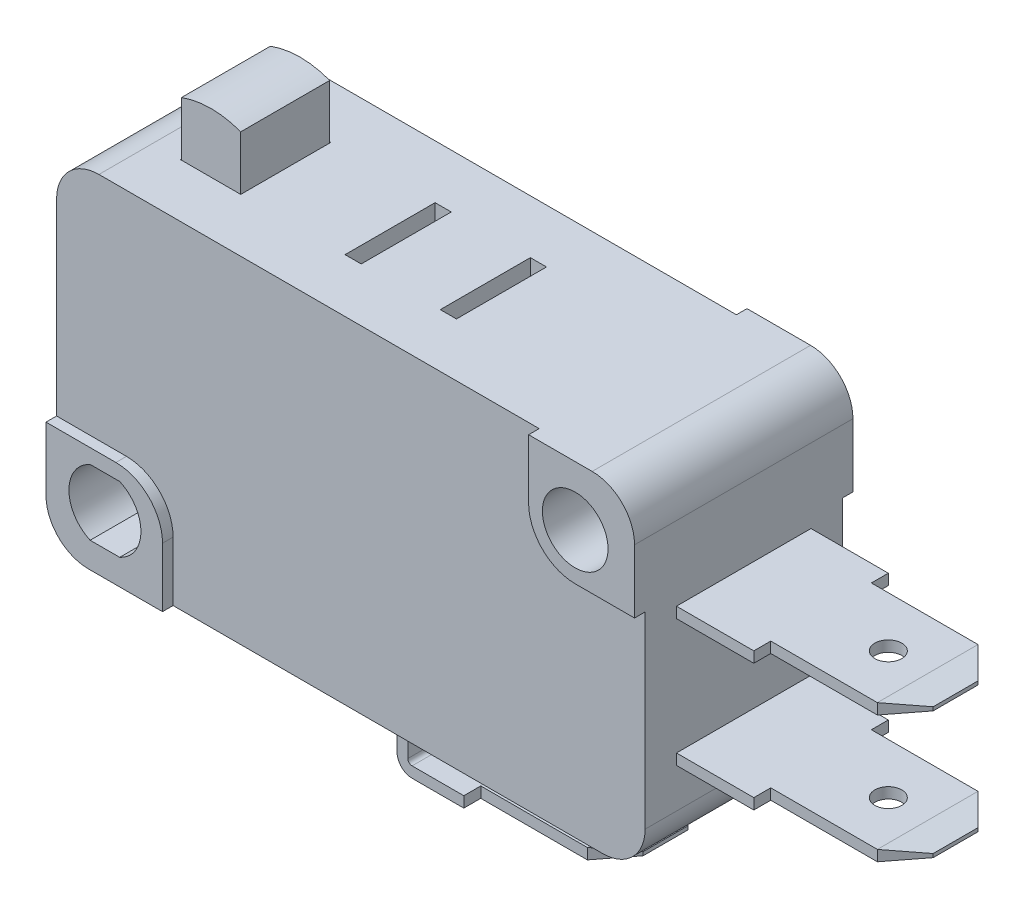
from build123d import *

# Parameters (mm, degrees)
SKETCH1_W               = 27.78125
SKETCH1_H               = 15.875
SKETCH1_R               = 1.55
EXTRUDE1_DEPTH          = 5.155
FILLET1_R               = 2
EXTRUDE2_DEPTH          = 2.1
SKETCH3_W               = 2.8508
SKETCH3_H               = 4.2508
SKETCH3_W_2             = 0.762
CUT_EXTRUDE1_DEPTH      = 2
CUT_EXTRUDE2_DEPTH      = 0.5
EXTRUDE3_DEPTH          = 3.175
SKETCH6_R               = 0.635
CUT_EXTRUDE3_DEPTH      = 26.744998173
EXTRUDE4_START          = -5.5
SKETCH8_R               = 0.635
EXTRUDE4_DEPTH          = 0.508
LPATTERN1_COUNT         = 2
LPATTERN1_PITCH         = 6
CUT_EXTRUDE4_DEPTH      = 27.735508115
CUT_EXTRUDE4_DEPTH_BACK = 27.735508115


with BuildPart() as part:
    # Sketch1 → Extrude1 (new, symmetric)
    with BuildSketch(Plane.XY):
        Rectangle(SKETCH1_W, SKETCH1_H)
        with Locations((11.090625, 5.1435)):
            Circle(SKETCH1_R, mode=Mode.SUBTRACT)
        with BuildLine():
            Line((-11.807587002, -3.62525), (-10.411162998, -3.62525))
            ThreePointArc((-10.411162998, -3.62525), (-9.409375, -5.17525), (-10.411162998, -6.72525))
            Line((-10.411162998, -6.72525), (-11.807587002, -6.72525))
            ThreePointArc((-11.807587002, -6.72525), (-12.809375, -5.17525), (-11.807587002, -3.62525))
        make_face(mode=Mode.SUBTRACT)
    extrude(amount=EXTRUDE1_DEPTH, both=True)

    # Fillet1
    fillet1_edges = [part.edges().sort_by_distance(p)[0] for p in [
        (-13.890625, 7.9375, 0),
        (13.890625, 7.9375, 0),
        (13.890625, -7.9375, 0),
        (-13.890625, -7.9375, 0),
    ]]
    fillet(fillet1_edges, radius=FILLET1_R)

    # Sketch3 → Cut-Extrude1 (cut)
    with BuildSketch(Plane(origin=(0, 7.9375, 0), x_dir=(-1, 0, 0), z_dir=(0, 1, 0))):
        with Locations((9.153175, 0)):
            Rectangle(SKETCH3_W, SKETCH3_H)
        with Locations((2.422175, 0)):
            Rectangle(SKETCH3_W_2, SKETCH3_H)
        with Locations((-2.073625, 0)):
            Rectangle(SKETCH3_W_2, SKETCH3_H)
    extrude(amount=-CUT_EXTRUDE1_DEPTH, mode=Mode.SUBTRACT)

    # Sketch4 → Cut-Extrude2 (cut)
    with BuildSketch(Plane.XY.offset(5.155)):
        with BuildLine():
            Line((-8.390625, -7.9375), (13.890625, -7.9375))
            Line((13.890625, -7.9375), (13.890625, 2.9435))
            Line((13.890625, 2.9435), (11.090625, 2.9435))
            ThreePointArc((11.090625, 2.9435), (9.534990081, 3.587865081), (8.890625, 5.1435))
            Line((8.890625, 5.1435), (8.890625, 7.9375))
            Line((8.890625, 7.9375), (-13.890625, 7.9375))
            Line((-13.890625, 7.9375), (-13.890625, -2.9375))
            Line((-13.890625, -2.9375), (-10.590625, -2.9375))
            ThreePointArc((-10.590625, -2.9375), (-9.034990081, -3.581865081), (-8.390625, -5.1375))
            Line((-8.390625, -5.1375), (-8.390625, -7.9375))
        make_face()
    cut_extrude2 = extrude(amount=-CUT_EXTRUDE2_DEPTH, mode=Mode.SUBTRACT)

    # Mirror1: Cut-Extrude2 across plane
    add(cut_extrude2.mirror(Plane.XY), mode=Mode.SUBTRACT)

    # Sketch5 → Extrude3 (add, symmetric)
    with BuildSketch(Plane.XY):
        with BuildLine():
            Line((0.701625, -7.9375), (0.701625, -10.1295))
            ThreePointArc((0.701625, -10.1295), (0.908993399, -10.630131601), (1.409625, -10.8375))
            Line((1.409625, -10.8375), (10.201625, -10.8375))
            Line((10.201625, -10.8375), (10.201625, -10.3295))
            Line((10.201625, -10.3295), (1.409625, -10.3295))
            ThreePointArc((1.409625, -10.3295), (1.268203644, -10.270921356), (1.209625, -10.1295))
            Line((1.209625, -10.1295), (1.209625, -7.9375))
            Line((1.209625, -7.9375), (0.701625, -7.9375))
        make_face()
    extrude(amount=EXTRUDE3_DEPTH, both=True)

    # Sketch6 → Cut-Extrude3 (cut, through all)
    with BuildSketch(Plane(origin=(0, -10.3295, 0), x_dir=(-1, 0, 0), z_dir=(0, 1, 0))):
        with Locations((-7.026625, 0)):
            Circle(SKETCH6_R)
        Polygon((-10.201625, 1.058333333), (-8.885058333, 2.3749), (-3.851625, 2.3749), (-3.851625, 3.175), (-10.201625, 3.175), align=None)
        Polygon((-10.201625, -3.175), (-10.201625, -1.058333333), (-8.885058333, -2.3749), (-3.851625, -2.3749), (-3.851625, -3.175), align=None)
    extrude(amount=-CUT_EXTRUDE3_DEPTH, mode=Mode.SUBTRACT)

    # Sketch8 → Extrude4 (add)
    with BuildSketch(Plane(origin=(0, 7.9375, 0), x_dir=(-1, 0, 0), z_dir=(0, 1, 0)).offset(EXTRUDE4_START)):
        Polygon((-13.890625, -3.175), (-17.540625, -3.175), (-17.540625, -2.3749), (-22.574058333, -2.3749), (-23.890625, -1.058333333), (-23.890625, 1.058333333), (-22.574058333, 2.3749), (-17.540625, 2.3749), (-17.540625, 3.175), (-13.890625, 3.175), align=None)
        with Locations((-20.715625, 0)):
            Circle(SKETCH8_R, mode=Mode.SUBTRACT)
    extrude4 = extrude(amount=-EXTRUDE4_DEPTH)

    # LPattern1: Extrude4 ×2
    with Locations(*[(0, -i * LPATTERN1_PITCH, 0) for i in range(1, LPATTERN1_COUNT)]):
        add(extrude4)

    # Sketch7 → Cut-Extrude4 (cut, two sides: drawn at the far end of the back side and taken through both)
    with BuildSketch(Plane.XY.offset(-CUT_EXTRUDE4_DEPTH_BACK)):
        Polygon((8.885058333, -10.3295), (10.201625, -10.3295), (10.201625, -10.498833333), align=None)
        Polygon((8.885058333, -10.8375), (10.201625, -10.8375), (10.201625, -10.668166667), align=None)
        Polygon((22.574058333, 2.4375), (23.890625, 2.268166667), (23.890625, 2.4375), align=None)
        Polygon((22.574058333, 1.9295), (23.890625, 1.9295), (23.890625, 2.098833333), align=None)
        Polygon((23.890625, -3.5625), (23.890625, -3.731833333), (22.574058333, -3.5625), align=None)
        Polygon((23.890625, -3.901166667), (23.890625, -4.0705), (22.574058333, -4.0705), align=None)
    extrude(amount=CUT_EXTRUDE4_DEPTH + CUT_EXTRUDE4_DEPTH_BACK, mode=Mode.SUBTRACT)


with BuildPart() as body_2:
    # Sketch2 → Extrude2 (new, symmetric)
    with BuildSketch(Plane.XY):
        with BuildLine():
            Line((-10.553175, 7.471748799), (-10.553175, 10.471748799))
            ThreePointArc((-10.553175, 10.471748799), (-9.153175, 10.72475), (-7.753175, 10.471748799))
            Line((-7.753175, 10.471748799), (-7.753175, 7.471748799))
            Line((-7.753175, 7.471748799), (-10.553175, 7.471748799))
        make_face()
    extrude(amount=EXTRUDE2_DEPTH, both=True)


solid = Compound([part.part, body_2.part])
